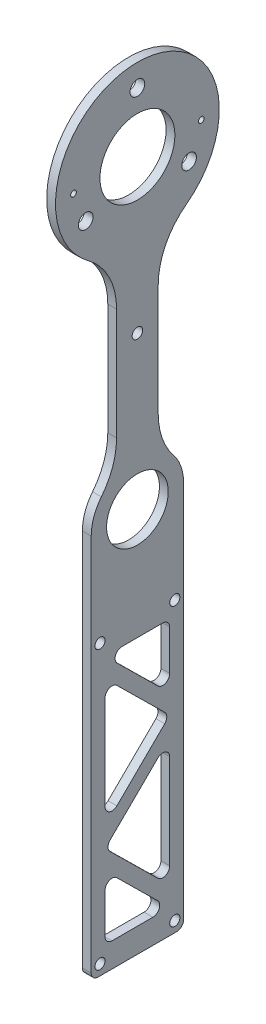
from build123d import *

# Parameters (mm, degrees)
SKETCH1_R                = 13.5
SKETCH1_R_2              = 1.8288
SKETCH1_R_3              = 11.1125
SKETCH1_R_4              = 2.65
BOSS_EXTRUDE1_DEPTH      = 3.175
CUT_EXTRUDE1_REACH       = 179.004
SKETCH2_W                = 4.112404804
SKETCH2_H                = 127.6975
FILLET3_R                = 2.5
FILLET4_R                = 25
M2_5X0_45_TAPPED_HOLE1_D = 2.05
F_6_CLEARANCE_HOLE1_D    = 3.7973


with BuildPart() as part:
    # Sketch1 → Boss-Extrude1 (new body)
    with BuildSketch(Plane(origin=(0, 0, 0), x_dir=(0, 0, -1), z_dir=(1, 0, 0))):
        with BuildLine():
            Line((20.757404804, -103.81), (20.757404804, -5))
            Line((20.757404804, -5), (16.645, 5.681808734))
            Line((16.645, 5.681808734), (16.645, 35))
            ThreePointArc((16.645, 35), (14.175569213, 43.724062271), (7.5, 49.85954323))
            Line((7.5, 49.85954323), (7.5, 116.469314765))
            ThreePointArc((7.5, 116.469314765), (0, 174.5), (-7.5, 116.469314765))
            Line((-7.5, 116.469314765), (-7.5, 49.85954323))
            ThreePointArc((-7.5, 49.85954323), (-14.175569213, 43.724062271), (-16.645, 35))
            Line((-16.645, 35), (-16.645, 5.681808734))
            Line((-16.645, 5.681808734), (-20.757404804, -5))
            Line((-20.757404804, -5), (-20.757404804, -103.81))
            Line((-20.757404804, -103.81), (20.757404804, -103.81))
        make_face()
        with Locations((0, 145)):
            Circle(SKETCH1_R, mode=Mode.SUBTRACT)
        with Locations((-13.4747, -100)):
            Circle(SKETCH1_R_2, mode=Mode.SUBTRACT)
        with Locations((13.4747, -100)):
            Circle(SKETCH1_R_2, mode=Mode.SUBTRACT)
        with Locations((-13.4747, 0)):
            Circle(SKETCH1_R_2, mode=Mode.SUBTRACT)
        with Locations((13.4747, 0)):
            Circle(SKETCH1_R_2, mode=Mode.SUBTRACT)
        with Locations((0, 35)):
            Circle(SKETCH1_R_3, mode=Mode.SUBTRACT)
        with Locations((18.619546181, 134.25)):
            Circle(SKETCH1_R_4, mode=Mode.SUBTRACT)
        with Locations((0, 166.5)):
            Circle(SKETCH1_R_4, mode=Mode.SUBTRACT)
        with Locations((-18.619546181, 134.25)):
            Circle(SKETCH1_R_4, mode=Mode.SUBTRACT)
    extrude(amount=BOSS_EXTRUDE1_DEPTH)

    # Sketch2 → Cut-Extrude1 (cut, up to next)
    with BuildSketch(Plane(origin=(3.175, 0, 0), x_dir=(0, 0, -1), z_dir=(1, 0, 0)), mode=Mode.PRIVATE) as cut_extrude1_sk1:
        Polygon((11.645, -5), (-11.645, -5), (11.645, -27.976379872), align=None)
    cut_extrude1_tool1 = extrude(cut_extrude1_sk1.sketch, amount=-CUT_EXTRUDE1_REACH, mode=Mode.PRIVATE) & part.part
    # Sketch2 → Cut-Extrude1 (cut, up to next)
    with BuildSketch(Plane(origin=(3.175, 0, 0), x_dir=(0, 0, -1), z_dir=(1, 0, 0)), mode=Mode.PRIVATE) as cut_extrude1_sk2:
        Polygon((-11.645, -12.023620128), (11.645, -35), (-11.645, -57.976379872), (-11.645, -35), align=None)
    cut_extrude1_tool2 = extrude(cut_extrude1_sk2.sketch, amount=-CUT_EXTRUDE1_REACH, mode=Mode.PRIVATE) & part.part
    # Sketch2 → Cut-Extrude1 (cut, up to next)
    with BuildSketch(Plane(origin=(3.175, 0, 0), x_dir=(0, 0, -1), z_dir=(1, 0, 0)), mode=Mode.PRIVATE) as cut_extrude1_sk3:
        Polygon((-11.645, -72.023620128), (-11.645, -95), (11.645, -95), align=None)
    cut_extrude1_tool3 = extrude(cut_extrude1_sk3.sketch, amount=-CUT_EXTRUDE1_REACH, mode=Mode.PRIVATE) & part.part
    # Sketch2 → Cut-Extrude1 (cut, up to next)
    with BuildSketch(Plane(origin=(3.175, 0, 0), x_dir=(0, 0, -1), z_dir=(1, 0, 0)), mode=Mode.PRIVATE) as cut_extrude1_sk4:
        Polygon((11.645, -42.023620128), (11.645, -65), (11.645, -87.976379872), (-11.645, -65), align=None)
    cut_extrude1_tool4 = extrude(cut_extrude1_sk4.sketch, amount=-CUT_EXTRUDE1_REACH, mode=Mode.PRIVATE) & part.part
    # Sketch2 → Cut-Extrude1 (cut, up to next)
    with BuildSketch(Plane(origin=(3.175, 0, 0), x_dir=(0, 0, -1), z_dir=(1, 0, 0)), mode=Mode.PRIVATE) as cut_extrude1_sk5:
        with Locations((-18.701202402, -39.96125)):
            Rectangle(SKETCH2_W, SKETCH2_H)
    cut_extrude1_tool5 = extrude(cut_extrude1_sk5.sketch, amount=-CUT_EXTRUDE1_REACH, mode=Mode.PRIVATE) & part.part
    # Sketch2 → Cut-Extrude1 (cut, up to next)
    with BuildSketch(Plane(origin=(3.175, 0, 0), x_dir=(0, 0, -1), z_dir=(1, 0, 0)), mode=Mode.PRIVATE) as cut_extrude1_sk6:
        with Locations((18.701202402, -39.96125)):
            Rectangle(SKETCH2_W, SKETCH2_H)
    cut_extrude1_tool6 = extrude(cut_extrude1_sk6.sketch, amount=-CUT_EXTRUDE1_REACH, mode=Mode.PRIVATE) & part.part
    add(cut_extrude1_tool1.solids().sort_by_distance((3.175, -12.658793, -3.881667))[0], mode=Mode.SUBTRACT)
    add(cut_extrude1_tool2.solids().sort_by_distance((3.175, -35, 3.881667))[0], mode=Mode.SUBTRACT)
    add(cut_extrude1_tool3.solids().sort_by_distance((3.175, -87.341207, 3.881667))[0], mode=Mode.SUBTRACT)
    add(cut_extrude1_tool4.solids().sort_by_distance((3.175, -65, -3.881667))[0], mode=Mode.SUBTRACT)
    add(cut_extrude1_tool5.solids().sort_by_distance((3.175, -39.96125, 18.701202))[0], mode=Mode.SUBTRACT)
    add(cut_extrude1_tool6.solids().sort_by_distance((3.175, -39.96125, -18.701202))[0], mode=Mode.SUBTRACT)

    # Fillet3
    fillet3_edges = [part.edges().sort_by_distance(p)[0] for p in [
        (1.5875, -103.81, 16.645),
        (1.5875, -12.023620128, 11.645),
        (1.5875, -35, -11.645),
        (1.5875, -57.976379872, 11.645),
        (1.5875, -103.81, -16.645),
        (1.5875, -72.023620128, 11.645),
        (1.5875, -95, -11.645),
        (1.5875, -95, 11.645),
        (1.5875, -87.976379872, -11.645),
        (1.5875, -65, 11.645),
        (1.5875, -42.023620128, -11.645),
        (1.5875, -27.976379872, -11.645),
        (1.5875, -5, 11.645),
        (1.5875, -5, -11.645),
    ]]
    fillet(fillet3_edges, radius=FILLET3_R)

    # Fillet4
    fillet4_edges = [part.edges().sort_by_distance(p)[0] for p in [
        (1.5875, 49.85954323, 7.5),
        (1.5875, 116.469314765, 7.5),
        (1.5875, 116.469314765, -7.5),
        (1.5875, 49.85954323, -7.5),
    ]]
    fillet(fillet4_edges, radius=FILLET4_R)

    # M2.5x0.45 Tapped Hole1 (through all)
    with Locations(Plane(origin=(3.175, 0, 0), x_dir=(0, 0, -1), z_dir=(1, 0, 0))):
        with Locations((23.015, 145), (-23.015, 145)):
            Hole(M2_5X0_45_TAPPED_HOLE1_D / 2)

    # #6 Clearance Hole1 (through all)
    with Locations(Plane(origin=(3.175, 0, 0), x_dir=(0, 0, -1), z_dir=(1, 0, 0))):
        with Locations((0, 90)):
            Hole(F_6_CLEARANCE_HOLE1_D / 2)


solid = part.part
